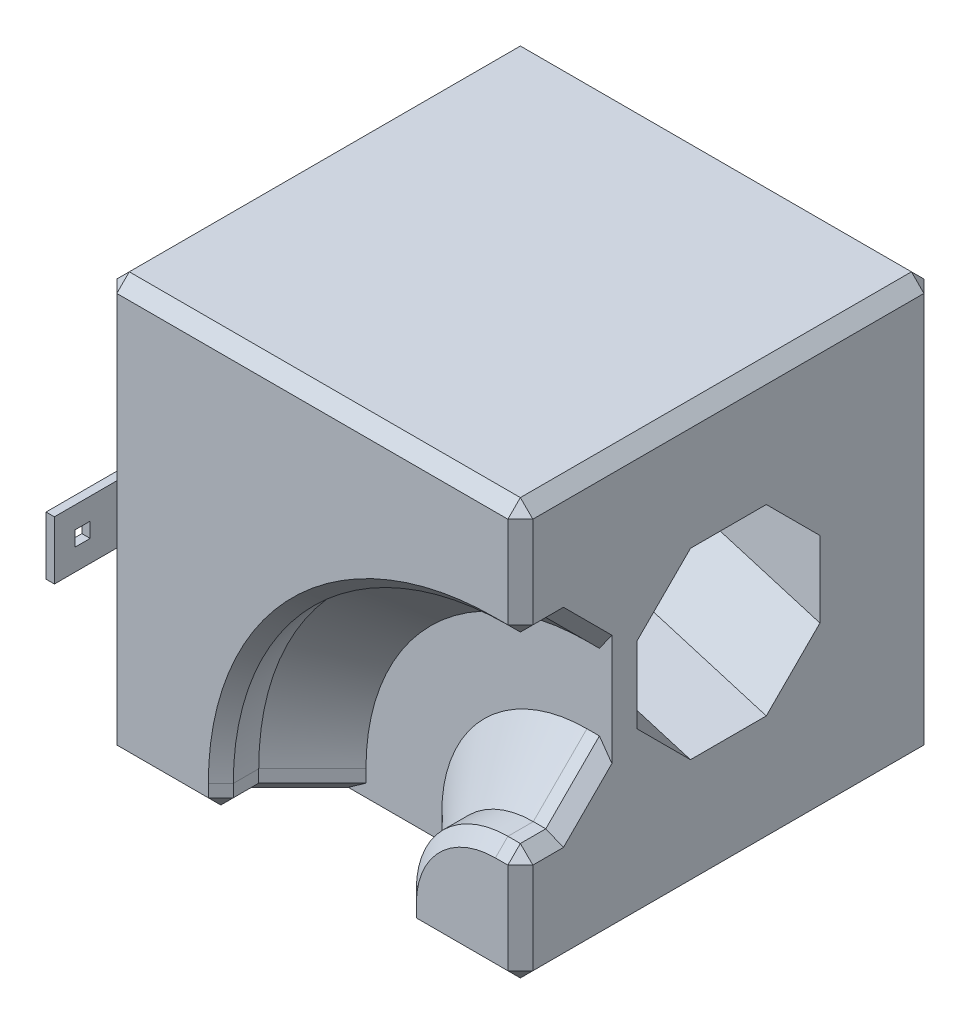
from build123d import *

# Parameters (mm, degrees)
SKETCH1_W                = 50
SKETCH1_H                = 50
BOSS_EXTRUDE1_DEPTH      = 50
CHAMFER1_SIZE            = 1.5
BOSS_EXTRUDE2_DEPTH      = 7
BOSS_EXTRUDE2_DEPTH_BACK = 10
SKETCH6_W                = 1
SKETCH6_H                = 7
SKETCH7_W                = 1.8
SKETCH7_H                = 1.8
CUT_EXTRUDE1_DEPTH       = 7


with BuildPart() as part:
    # Sketch1 → Boss-Extrude1 (new body)
    with BuildSketch(Plane.XY):
        with Locations((25, 25)):
            Rectangle(SKETCH1_W, SKETCH1_H)
    extrude(amount=BOSS_EXTRUDE1_DEPTH)

    # Cut-Sweep1: sweep along a path in Sketch4
    with BuildLine(Plane.XY.offset(50)) as cut_sweep1_path:
        Line((25, 0), (25, 3))
        ThreePointArc((25, 3), (31.443650814, 18.556349186), (47, 25))
        Line((47, 25), (50, 25))
    # Sketch3 → Cut-Sweep1 (sweep, cut)
    with BuildSketch(Plane.XZ):
        Polygon((29.556349186, 39), (36, 45.443650814), (36, 54.556349186), (29.556349186, 61), (20.443650814, 61), (14, 54.556349186), (14, 45.443650814), (20.443650814, 39), align=None)
    sweep(path=cut_sweep1_path.line, mode=Mode.SUBTRACT)

    # Sketch5 → Cut-Loft1 section 0
    with BuildSketch(Plane.ZY):
        with BuildLine():
            Line((18.056349186, 36), (8.943650814, 36))
            Line((8.943650814, 36), (2.5, 29.556349186))
            Line((2.5, 29.556349186), (2.5, 20.443650814))
            Line((2.5, 20.443650814), (8.943650814, 14))
            Line((8.943650814, 14), (18.056349186, 14))
            Line((18.056349186, 14), (24.5, 20.443650814))
            Line((24.5, 20.443650814), (24.5, 29.556349186))
            Line((24.5, 29.556349186), (18.056349186, 36))
        make_face()
    # Sketch2 → Cut-Loft1 section 1
    with BuildSketch(Plane.ZY.offset(-50)):
        with BuildLine():
            Line((36, 29.556349186), (29.556349186, 36))
            Line((29.556349186, 36), (20.443650814, 36))
            Line((20.443650814, 36), (14, 29.556349186))
            Line((14, 29.556349186), (14, 20.443650814))
            Line((14, 20.443650814), (20.443650814, 14))
            Line((20.443650814, 14), (29.556349186, 14))
            Line((29.556349186, 14), (36, 20.443650814))
            Line((36, 20.443650814), (36, 29.556349186))
        make_face()
    loft(mode=Mode.SUBTRACT)

    # Chamfer1
    chamfer1_edges = [part.edges().sort_by_distance(p)[0] for p in [
        (50, 7, 50),
        (25, 50, 50),
        (43, 0, 50),
        (50, 43, 50),
        (36, 1.5, 50),
        (39.221825407, 10.778174593, 50),
        (48.5, 14, 50),
        (14, 1.5, 50),
        (23.665476221, 26.334523779, 50),
        (48.5, 36, 50),
        (50, 36, 47.721825407),
        (50, 14, 47.721825407),
        (36, 0, 47.721825407),
        (14, 0, 47.721825407),
        (17.221825407, 0, 42.221825407),
        (32.778174593, 0, 42.221825407),
        (50, 32.778174593, 42.221825407),
        (50, 17.221825407, 42.221825407),
        (0, 25, 50),
        (25, 50, 0),
        (50, 25, 0),
        (25, 0, 0),
        (0, 25, 0),
        (7, 0, 50),
        (0, 50, 25),
        (50, 50, 25),
        (50, 0, 25),
        (0, 0, 25),
    ]]
    chamfer(chamfer1_edges, length=CHAMFER1_SIZE)

    # Sketch6 → Boss-Extrude2 (add, two sides: drawn at the far end of the back side and taken through both)
    with BuildSketch(Plane.XY.offset(50).offset(-BOSS_EXTRUDE2_DEPTH_BACK)):
        with Locations((0.5, 25)):
            Rectangle(SKETCH6_W, SKETCH6_H)
    extrude(amount=BOSS_EXTRUDE2_DEPTH + BOSS_EXTRUDE2_DEPTH_BACK)

    # Sketch7 → Cut-Extrude1 (cut)
    with BuildSketch(Plane(origin=(1, 0, 0), x_dir=(0, 0, -1), z_dir=(1, 0, 0))):
        with Locations((-53.6, 25)):
            Rectangle(SKETCH7_W, SKETCH7_H)
    extrude(amount=-CUT_EXTRUDE1_DEPTH, mode=Mode.SUBTRACT)


solid = part.part
